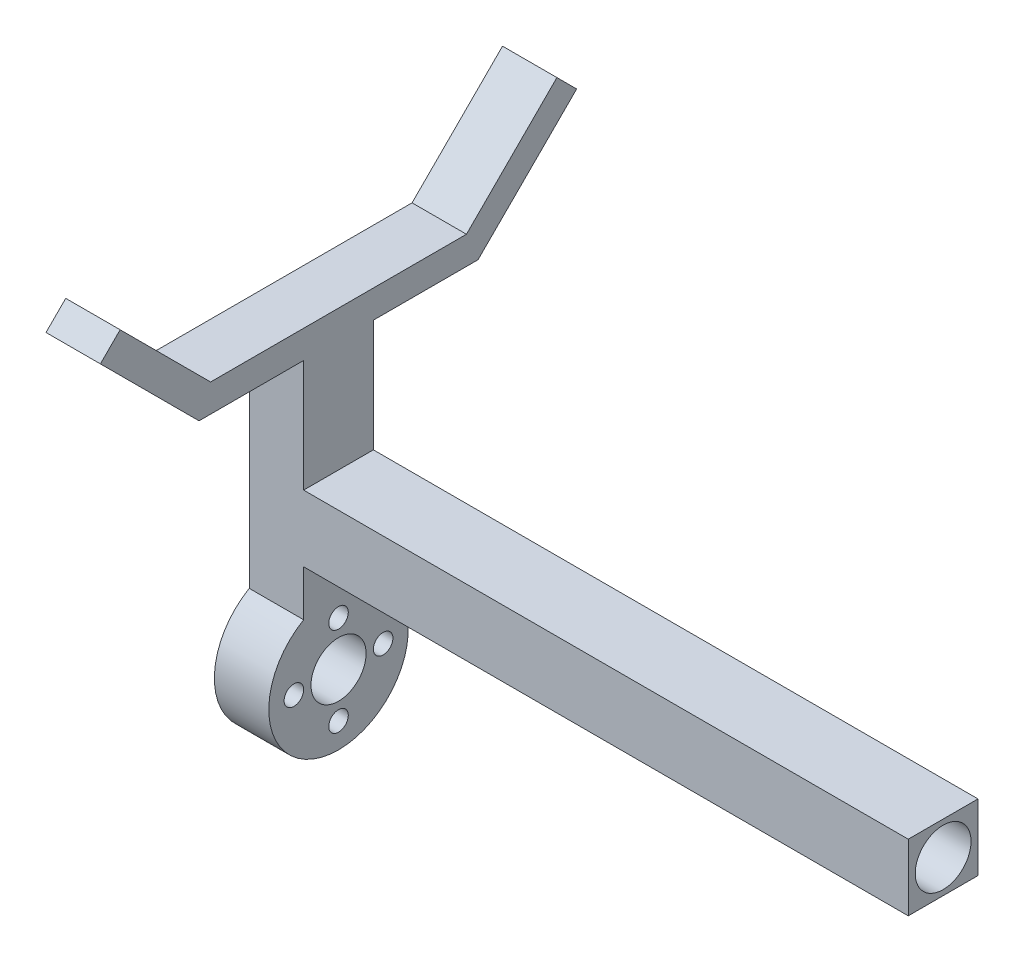
from build123d import *

# Parameters (mm, degrees)
SKETCH1_R           = 5.0165
SKETCH1_R_2         = 1.778
BOSS_EXTRUDE1_DEPTH = 9.906
BOSS_EXTRUDE2_DEPTH = 9.906
BOSS_EXTRUDE3_START = -9.906
SKETCH4_W           = 12.7
SKETCH4_H           = 12.091045256
BOSS_EXTRUDE3_DEPTH = 110.094000005
SKETCH5_R           = 5.08
CUT_EXTRUDE1_DEPTH  = 12.7


with BuildPart() as part:
    # Sketch1 → Boss-Extrude1 (new body)
    with BuildSketch(Plane(origin=(0, 0, 0), x_dir=(0, 0, -1), z_dir=(1, 0, 0))):
        with BuildLine():
            Line((-6.35, 10.998522628), (-6.35, 51.892522628))
            Line((-6.35, 51.892522628), (6.35, 51.892522628))
            Line((6.35, 51.892522628), (6.35, 10.998522628))
            ThreePointArc((6.35, 10.998522628), (0, -12.7), (-6.35, 10.998522628))
        make_face()
        Circle(SKETCH1_R, mode=Mode.SUBTRACT)
        with Locations((-8.128, 0)):
            Circle(SKETCH1_R_2, mode=Mode.SUBTRACT)
        with Locations((0, 8.128)):
            Circle(SKETCH1_R_2, mode=Mode.SUBTRACT)
        with Locations((8.128, 0)):
            Circle(SKETCH1_R_2, mode=Mode.SUBTRACT)
        with Locations((0, -8.128)):
            Circle(SKETCH1_R_2, mode=Mode.SUBTRACT)
    extrude(amount=BOSS_EXTRUDE1_DEPTH)

    # Sketch3 → Boss-Extrude2 (add)
    with BuildSketch(Plane(origin=(0, 0, 0), x_dir=(0, 0, -1), z_dir=(1, 0, 0))):
        Polygon((-25.4, 51.892522628), (0, 51.892522628), (0, 56.972522628), (-23.295795103, 56.972522628), (-39.768409794, 73.445137319), (-43.360512242, 69.85303487), align=None)
        Polygon((0, 51.892522628), (25.4, 51.892522628), (43.360512242, 69.85303487), (39.768409794, 73.445137319), (23.295795103, 56.972522628), (0, 56.972522628), align=None)
    extrude(amount=BOSS_EXTRUDE2_DEPTH)

    # Sketch4 → Boss-Extrude3 (add)
    with BuildSketch(Plane.ZY.offset(BOSS_EXTRUDE3_START)):
        with Locations((0, 25.4)):
            Rectangle(SKETCH4_W, SKETCH4_H)
    extrude(amount=-BOSS_EXTRUDE3_DEPTH)

    # Sketch5 → Cut-Extrude1 (cut)
    with BuildSketch(Plane(origin=(120.000000005, 0, 0), x_dir=(0, 0, -1), z_dir=(1, 0, 0))):
        with Locations((0, 25.4)):
            Circle(SKETCH5_R)
    extrude(amount=-CUT_EXTRUDE1_DEPTH, mode=Mode.SUBTRACT)


solid = part.part
